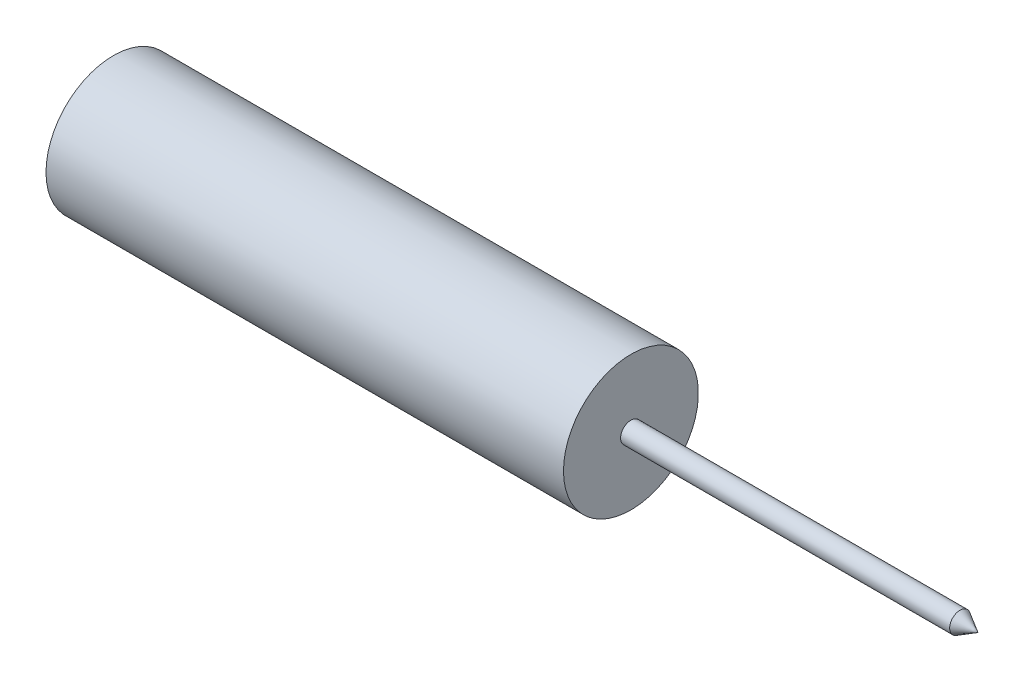
from build123d import *


with BuildPart() as part:
    # Sketch1 → Revolve1 (revolve)
    with BuildSketch(Plane(origin=(0, 0, 0), x_dir=(1, 0, 0), z_dir=(0, 1, 0)), mode=Mode.PRIVATE) as revolve1_sk:
        Polygon((40.7979994, 0.5), (41.664024804, 0), (0, 0), (0, 3.25), (24.9379994, 3.25), (24.9379994, 0.5), align=None)
    revolve(revolve1_sk.sketch.rotate(Axis((0, 0, 0), (1, 0, 0)), 180), axis=Axis((0, 0, 0), (1, 0, 0)))


solid = part.part
